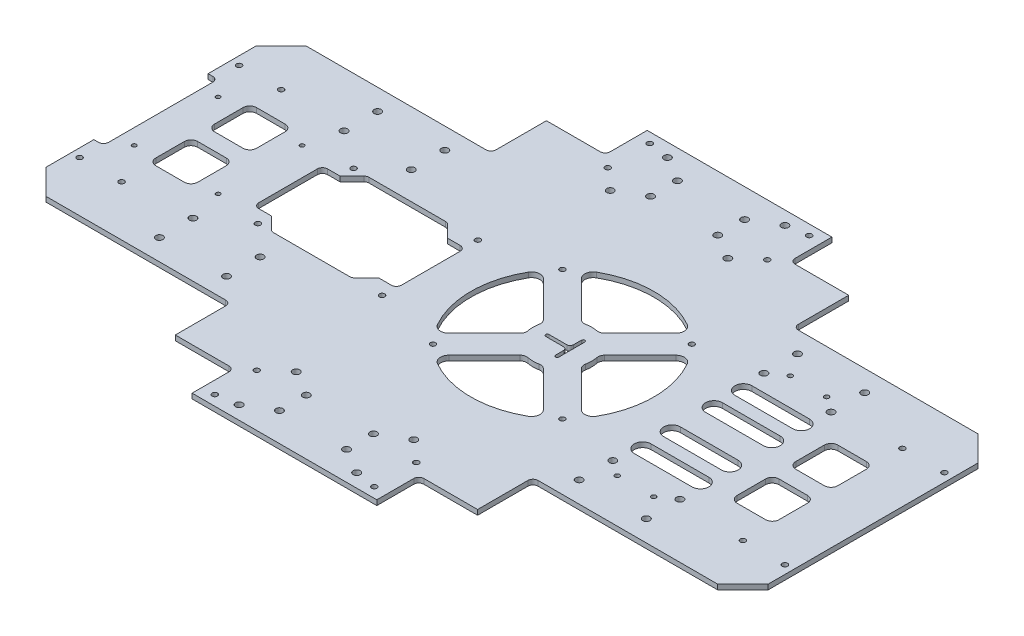
from build123d import *

# Parameters (mm, degrees)
EXTRUDE_1_DEPTH     = 3
FILLET_1_R          = 3
SKETCH_2_R          = 1.6
CUT_EXTRUDE_1_DEPTH = 47
SKETCH_3_R          = 2.1
SKETCH_3_R_2        = 1.4
SKETCH_3_R_3        = 1.25
CUT_EXTRUDE_2_DEPTH = 47
CHAMFER_1_SIZE      = 15
SKETCH_5_R          = 1.55
CUT_EXTRUDE_3_DEPTH = 47
SKETCH_6_R          = 1.6
CUT_EXTRUDE_4_DEPTH = 47
FILLET_2_R          = 3
CUT_EXTRUDE_5_DEPTH = 47
FILLET_3_R          = 3
CUT_EXTRUDE_6_DEPTH = 47
CUT_EXTRUDE_7_DEPTH = 10
FILLET_4_R          = 3
SKETCH_10_R         = 2.1
CUT_EXTRUDE_8_DEPTH = 10
SKETCH_11_R         = 2.1
CUT_EXTRUDE_9_DEPTH = 10


with BuildPart() as part:
    # 草图1 → 凸台-拉伸1 (new body)
    with BuildSketch(Plane(origin=(0, 0, 0), x_dir=(1, 0, 0), z_dir=(0, 1, 0))):
        Polygon((-82.930073268, 135.499923245), (-82.930073268, 112.499923245), (-47.930073268, 112.499923245), (-47.930073268, 77.499923245), (77.069926732, 77.499923245), (77.069926732, -77.499923245), (-47.930073268, -77.499923245), (-47.930073268, -112.499923245), (-82.930073268, -112.499923245), (-82.930073268, -135.499923245), (-192.930073268, -135.499923245), (-192.930073268, -112.499923245), (-227.930073268, -112.499923245), (-227.930073268, -77.499923245), (-352.930073268, -77.499923245), (-352.930073268, 77.499923245), (-227.930073268, 77.499923245), (-227.930073268, 112.499923245), (-192.930073268, 112.499923245), (-192.930073268, 135.499923245), align=None)
    extrude(amount=EXTRUDE_1_DEPTH)

    # 圆角1
    fillet_1_edges = [part.edges().sort_by_distance(p)[0] for p in [
        (-227.930073268, 1.5, 77.499923245),
        (-227.930073268, 1.5, -77.499923245),
        (-192.930073268, 1.5, -112.499923245),
        (-82.930073268, 1.5, -112.499923245),
        (-47.930073268, 1.5, -77.499923245),
        (-47.930073268, 1.5, 77.499923245),
        (-82.930073268, 1.5, 112.499923245),
        (-192.930073268, 1.5, 112.499923245),
    ]]
    fillet(fillet_1_edges, radius=FILLET_1_R)

    # 草图2 → 切除-拉伸1 (cut)
    with BuildSketch(Plane(origin=(0, 3, 0), x_dir=(1, 0, 0), z_dir=(0, 1, 0))):
        with Locations(Location((47.069926732, 47.5, 0), (0, 0, 270))):
            Circle(SKETCH_2_R)
        with Locations(Location((72.069926732, 47.5, 0), (0, 0, 270))):
            Circle(SKETCH_2_R)
        with Locations(Location((47.069926732, -47.5, 0), (0, 0, 270))):
            Circle(SKETCH_2_R)
        with Locations(Location((72.069926732, -47.5, 0), (0, 0, 270))):
            Circle(SKETCH_2_R)
        with Locations(Location((-185.430073268, 104.499923245, 0), (0, 0, 270))):
            Circle(SKETCH_2_R)
        with Locations(Location((-90.430073268, 129.499923245, 0), (0, 0, 270))):
            Circle(SKETCH_2_R)
        with Locations(Location((-90.430073268, 104.499923245, 0), (0, 0, 270))):
            Circle(SKETCH_2_R)
        with Locations(Location((-185.430073268, 129.499923245, 0), (0, 0, 270))):
            Circle(SKETCH_2_R)
        with Locations(Location((-185.430073268, -129.499923245, 0), (0, 0, 90))):
            Circle(SKETCH_2_R)
        with Locations(Location((-90.430073268, -104.499923245, 0), (0, 0, 90))):
            Circle(SKETCH_2_R)
        with Locations(Location((-90.430073268, -129.499923245, 0), (0, 0, 90))):
            Circle(SKETCH_2_R)
        with Locations(Location((-185.430073268, -104.499923245, 0), (0, 0, 90))):
            Circle(SKETCH_2_R)
        with Locations(Location((-347.930073268, -47.5, 0), (0, 0, 90))):
            Circle(SKETCH_2_R)
        with Locations(Location((-322.930073268, -47.5, 0), (0, 0, 90))):
            Circle(SKETCH_2_R)
        with Locations(Location((-347.930073268, 47.5, 0), (0, 0, 90))):
            Circle(SKETCH_2_R)
        with Locations(Location((-322.930073268, 47.5, 0), (0, 0, 90))):
            Circle(SKETCH_2_R)
    extrude(amount=-CUT_EXTRUDE_1_DEPTH, mode=Mode.SUBTRACT)

    # 草图3 → 切除-拉伸2 (cut)
    with BuildSketch(Plane(origin=(0, 3, 0), x_dir=(1, 0, 0), z_dir=(0, 1, 0))):
        with Locations(Location((-282.930073268, 65, 0), (0, 0, 270))):
            Circle(SKETCH_3_R)
        with Locations(Location((-282.930073268, 45, 0), (0, 0, 270))):
            Circle(SKETCH_3_R)
        with Locations(Location((-242.930073268, 65, 0), (0, 0, 270))):
            Circle(SKETCH_3_R)
        with Locations(Location((-242.930073268, 45, 0), (0, 0, 270))):
            Circle(SKETCH_3_R)
        with Locations(Location((-242.930073268, -45, 0), (0, 0, 90))):
            Circle(SKETCH_3_R)
        with Locations(Location((-242.930073268, -65, 0), (0, 0, 90))):
            Circle(SKETCH_3_R)
        with Locations(Location((-282.930073268, -45, 0), (0, 0, 90))):
            Circle(SKETCH_3_R)
        with Locations(Location((-282.930073268, -65, 0), (0, 0, 90))):
            Circle(SKETCH_3_R)
        with Locations(Location((7.069926732, -65, 0), (0, 0, 270))):
            Circle(SKETCH_3_R)
        with Locations(Location((7.069926732, -45, 0), (0, 0, 270))):
            Circle(SKETCH_3_R)
        with Locations(Location((-32.930073268, -65, 0), (0, 0, 270))):
            Circle(SKETCH_3_R)
        with Locations(Location((-32.930073268, -45, 0), (0, 0, 270))):
            Circle(SKETCH_3_R)
        with Locations(Location((-32.930073268, 45, 0), (0, 0, 90))):
            Circle(SKETCH_3_R)
        with Locations(Location((-32.930073268, 65, 0), (0, 0, 90))):
            Circle(SKETCH_3_R)
        with Locations(Location((7.069926732, 45, 0), (0, 0, 90))):
            Circle(SKETCH_3_R)
        with Locations(Location((7.069926732, 65, 0), (0, 0, 90))):
            Circle(SKETCH_3_R)
        with Locations(Location((-23.76704514, -51.499999755, 0), (0, 0, 270))):
            Circle(SKETCH_3_R_2)
        with Locations(Location((-2.093100904, -51.499999755, 0), (0, 0, 270))):
            Circle(SKETCH_3_R_2)
        with Locations(Location((-23.767045988, 51.50000033, 0), (0, 0, 270))):
            Circle(SKETCH_3_R_2)
        with Locations(Location((-2.09310104, 51.50000033, 0), (0, 0, 270))):
            Circle(SKETCH_3_R_2)
        with Locations(Location((-337.930073268, 25, 0), (0, 0, 270))):
            Circle(SKETCH_3_R_3)
        with Locations(Location((-287.930073268, 25, 0), (0, 0, 270))):
            Circle(SKETCH_3_R_3)
        with Locations(Location((-287.930073268, -25, 0), (0, 0, 270))):
            Circle(SKETCH_3_R_3)
        with Locations(Location((-337.930073268, -25, 0), (0, 0, 270))):
            Circle(SKETCH_3_R_3)
        with BuildLine():
            Line((-30.125760882, 35), (4.265614346, 35))
            ThreePointArc((4.265614346, 35), (9.265614346, 30), (4.265614346, 25))
            Line((4.265614346, 25), (-8.930073268, 25))
            Line((-8.930073268, 25), (-12.930073268, 25))
            Line((-12.930073268, 25), (-30.125760882, 25))
            ThreePointArc((-30.125760882, 25), (-35.125760882, 30), (-30.125760882, 35))
        make_face()
        with BuildLine():
            Line((-30.125760882, 17.5), (4.265614346, 17.5))
            ThreePointArc((4.265614346, 17.5), (9.265614346, 12.5), (4.265614346, 7.5))
            Line((4.265614346, 7.5), (-30.125760882, 7.5))
            ThreePointArc((-30.125760882, 7.5), (-35.125760882, 12.5), (-30.125760882, 17.5))
        make_face()
        with BuildLine():
            Line((-30.125760882, -35), (4.265614346, -35))
            ThreePointArc((4.265614346, -35), (9.265614346, -30), (4.265614346, -25))
            Line((4.265614346, -25), (-30.125760882, -25))
            ThreePointArc((-30.125760882, -25), (-35.125760882, -30), (-30.125760882, -35))
        make_face()
        with BuildLine():
            Line((-30.125760882, -17.5), (4.265614346, -17.5))
            ThreePointArc((4.265614346, -17.5), (9.265614346, -12.5), (4.265614346, -7.5))
            Line((4.265614346, -7.5), (-30.125760882, -7.5))
            ThreePointArc((-30.125760882, -7.5), (-35.125760882, -12.5), (-30.125760882, -17.5))
        make_face()
    extrude(amount=-CUT_EXTRUDE_2_DEPTH, mode=Mode.SUBTRACT)

    # 倒角1
    chamfer_1_edges = [part.edges().sort_by_distance(p)[0] for p in [
        (-352.930073268, 1.5, 77.499923245),
        (-352.930073268, 1.5, -77.499923245),
        (77.069926732, 1.5, -77.499923245),
        (77.069926732, 1.5, 77.499923245),
    ]]
    chamfer(chamfer_1_edges, length=CHAMFER_1_SIZE)

    # 草图5 → 切除-拉伸3 (cut)
    with BuildSketch(Plane(origin=(0, 3, 0), x_dir=(1, 0, 0), z_dir=(0, 1, 0))):
        with Locations(Location((-69.392753694, 38.537319575, 0), (0, 0, 270))):
            Circle(SKETCH_5_R)
        with Locations(Location((-69.392753694, -38.537319575, 0), (0, 0, 270))):
            Circle(SKETCH_5_R)
        with Locations(Location((-146.467392843, -38.537319575, 0), (0, 0, 270))):
            Circle(SKETCH_5_R)
        with Locations(Location((-146.467392843, 38.537319575, 0), (0, 0, 270))):
            Circle(SKETCH_5_R)
        with BuildLine():
            Line((-68.500078803, 28.116285966), (-89.658743207, 6.957621562))
            ThreePointArc((-89.658743207, 6.957621562), (-90.656276987, 5.296251914), (-90.755852303, 3.360972216))
            ThreePointArc((-90.755852303, 3.360972216), (-90.430073268, 0), (-90.755852303, -3.360972216))
            ThreePointArc((-90.755852303, -3.360972216), (-90.656276987, -5.296251914), (-89.658743207, -6.957621562))
            Line((-89.658743207, -6.957621562), (-68.500078803, -28.116285966))
            ThreePointArc((-68.500078803, -28.116285966), (-64.302140518, -29.536679868), (-60.624592537, -27.063656308))
            ThreePointArc((-60.624592537, -27.063656308), (-53.430073268, 0), (-60.624592537, 27.063656308))
            ThreePointArc((-60.624592537, 27.063656308), (-64.302140518, 29.536679868), (-68.500078803, 28.116285966))
        make_face()
        with BuildLine():
            Line((-79.813787302, -39.429994465), (-100.972451706, -18.271330061))
            ThreePointArc((-100.972451706, -18.271330061), (-102.633821354, -17.273796281), (-104.569101052, -17.174220965))
            ThreePointArc((-104.569101052, -17.174220965), (-107.930073268, -17.5), (-111.291045485, -17.174220965))
            ThreePointArc((-111.291045485, -17.174220965), (-113.226325182, -17.273796281), (-114.88769483, -18.271330061))
            Line((-114.88769483, -18.271330061), (-136.046359234, -39.429994465))
            ThreePointArc((-136.046359234, -39.429994465), (-137.466753136, -43.62793275), (-134.993729577, -47.305480731))
            ThreePointArc((-134.993729577, -47.305480731), (-107.930073268, -54.5), (-80.86641696, -47.305480731))
            ThreePointArc((-80.86641696, -47.305480731), (-78.3933934, -43.62793275), (-79.813787302, -39.429994465))
        make_face()
        with BuildLine():
            Line((-147.360067733, -28.116285966), (-126.201403329, -6.957621562))
            ThreePointArc((-126.201403329, -6.957621562), (-125.203869549, -5.296251914), (-125.104294233, -3.360972216))
            ThreePointArc((-125.104294233, -3.360972216), (-125.430073268, 0), (-125.104294233, 3.360972216))
            ThreePointArc((-125.104294233, 3.360972216), (-125.203869549, 5.296251914), (-126.201403329, 6.957621562))
            Line((-126.201403329, 6.957621562), (-147.360067733, 28.116285966))
            ThreePointArc((-147.360067733, 28.116285966), (-151.558006018, 29.536679868), (-155.235554, 27.063656308))
            ThreePointArc((-155.235554, 27.063656308), (-162.430073268, 0), (-155.235554, -27.063656308))
            ThreePointArc((-155.235554, -27.063656308), (-151.558006018, -29.536679868), (-147.360067733, -28.116285966))
        make_face()
        with BuildLine():
            Line((-136.046359234, 39.429994465), (-114.88769483, 18.271330061))
            ThreePointArc((-114.88769483, 18.271330061), (-113.226325182, 17.273796281), (-111.291045485, 17.174220965))
            ThreePointArc((-111.291045485, 17.174220965), (-107.930073268, 17.5), (-104.569101052, 17.174220965))
            ThreePointArc((-104.569101052, 17.174220965), (-102.633821354, 17.273796281), (-100.972451706, 18.271330061))
            Line((-100.972451706, 18.271330061), (-79.813787302, 39.429994465))
            ThreePointArc((-79.813787302, 39.429994465), (-78.3933934, 43.62793275), (-80.86641696, 47.305480731))
            ThreePointArc((-80.86641696, 47.305480731), (-107.930073268, 54.5), (-134.993729577, 47.305480731))
            ThreePointArc((-134.993729577, 47.305480731), (-137.466753136, 43.62793275), (-136.046359234, 39.429994465))
        make_face()
        with BuildLine():
            Line((-102.329796638, -7.703070081), (-102.329796638, 7.767864593))
            ThreePointArc((-102.329796638, 7.767864593), (-103.329796638, 8.767864593), (-104.329796638, 7.767864593))
            Line((-104.329796638, 7.767864593), (-104.329796638, 3.032397256))
            ThreePointArc((-104.329796638, 3.032397256), (-104.915583076, 1.618183694), (-106.329796638, 1.032397256))
            Line((-106.329796638, 1.032397256), (-116.930073268, 1.032397256))
            ThreePointArc((-116.930073268, 1.032397256), (-117.930073268, 0.032397256), (-116.930073268, -0.967602744))
            Line((-116.930073268, -0.967602744), (-106.329796638, -0.967602744))
            ThreePointArc((-106.329796638, -0.967602744), (-104.915583076, -1.553389182), (-104.329796638, -2.967602744))
            Line((-104.329796638, -2.967602744), (-104.329796638, -7.703070081))
            ThreePointArc((-104.329796638, -7.703070081), (-103.329796638, -8.703070081), (-102.329796638, -7.703070081))
        make_face()
    extrude(amount=-CUT_EXTRUDE_3_DEPTH, mode=Mode.SUBTRACT)

    # 草图6 → 切除-拉伸4 (cut)
    with BuildSketch(Plane(origin=(0, 3, 0), x_dir=(1, 0, 0), z_dir=(0, 1, 0))):
        with Locations(Location((-260.782474962, 28.5, 0), (0, 0, 270))):
            Circle(SKETCH_6_R)
        with Locations(Location((-186.782474962, 28.5, 0), (0, 0, 270))):
            Circle(SKETCH_6_R)
        with Locations(Location((-260.782474962, -28.5, 0), (0, 0, 270))):
            Circle(SKETCH_6_R)
        with Locations(Location((-186.782474962, -28.5, 0), (0, 0, 270))):
            Circle(SKETCH_6_R)
        Polygon((-270.282474962, -20.5), (-260.782474962, -20.5), (-252.782474962, -28.5), (-204.782474962, -28.5), (-196.782474962, -20.5), (-187.282474962, -20.5), (-186.282474962, -20.5), (-186.282474962, -19.5), (-186.282474962, 19.5), (-186.282474962, 20.5), (-187.282474962, 20.5), (-196.782474962, 20.5), (-204.782474962, 28.5), (-252.782474962, 28.5), (-260.782474962, 20.5), (-270.282474962, 20.5), (-271.282474962, 20.5), (-271.282474962, 19.5), (-271.282474962, -19.5), (-271.282474962, -20.5), align=None)
    extrude(amount=-CUT_EXTRUDE_4_DEPTH, mode=Mode.SUBTRACT)

    # 圆角2
    fillet_2_edges = [part.edges().sort_by_distance(p)[0] for p in [
        (-271.282474962, 1.5, 20.5),
        (-271.282474962, 1.5, -20.5),
        (-252.782474962, 1.5, -28.5),
        (-204.782474962, 1.5, -28.5),
        (-186.282474962, 1.5, -20.5),
        (-186.282474962, 1.5, 20.5),
        (-204.782474962, 1.5, 28.5),
        (-252.782474962, 1.5, 28.5),
    ]]
    fillet(fillet_2_edges, radius=FILLET_2_R)

    # 草图7 → 切除-拉伸5 (cut)
    with BuildSketch(Plane(origin=(0, 3, 0), x_dir=(1, 0, 0), z_dir=(0, 1, 0))):
        Polygon((-347.130073268, 0), (-347.130073268, 34), (-352.930073268, 34), (-352.930073268, -34), (-347.130073268, -34), align=None)
    extrude(amount=-CUT_EXTRUDE_5_DEPTH, mode=Mode.SUBTRACT)

    # 圆角3
    fillet_3_edges = [part.edges().sort_by_distance(p)[0] for p in [
        (-347.130073268, 1.5, 34),
        (-347.130073268, 1.5, -34),
    ]]
    fillet(fillet_3_edges, radius=FILLET_3_R)

    # 草图8 → 切除-拉伸6 (cut)
    with BuildSketch(Plane(origin=(0, 3, 0), x_dir=(1, 0, 0), z_dir=(0, 1, 0))):
        with BuildLine():
            Line((-321.030465446, 5.960941227), (-304.030465446, 5.960941227))
            ThreePointArc((-304.030465446, 5.960941227), (-301.202038321, 7.132514102), (-300.030465446, 9.960941227))
            Line((-300.030465446, 9.960941227), (-300.030465446, 26.960941227))
            ThreePointArc((-300.030465446, 26.960941227), (-301.202038321, 29.789368352), (-304.030465446, 30.960941227))
            Line((-304.030465446, 30.960941227), (-321.030465446, 30.960941227))
            ThreePointArc((-321.030465446, 30.960941227), (-323.858892571, 29.789368352), (-325.030465446, 26.960941227))
            Line((-325.030465446, 26.960941227), (-325.030465446, 9.960941227))
            ThreePointArc((-325.030465446, 9.960941227), (-323.858892571, 7.132514102), (-321.030465446, 5.960941227))
        make_face()
        with BuildLine():
            Line((-300.030465446, -8.039058773), (-300.030465446, -25.039058773))
            ThreePointArc((-300.030465446, -25.039058773), (-301.202038321, -27.867485898), (-304.030465446, -29.039058773))
            Line((-304.030465446, -29.039058773), (-321.030465446, -29.039058773))
            ThreePointArc((-321.030465446, -29.039058773), (-323.858892571, -27.867485898), (-325.030465446, -25.039058773))
            Line((-325.030465446, -25.039058773), (-325.030465446, -8.039058773))
            ThreePointArc((-325.030465446, -8.039058773), (-323.858892571, -5.210631648), (-321.030465446, -4.039058773))
            Line((-321.030465446, -4.039058773), (-304.030465446, -4.039058773))
            ThreePointArc((-304.030465446, -4.039058773), (-301.202038321, -5.210631648), (-300.030465446, -8.039058773))
        make_face()
        with BuildLine():
            ThreePointArc((22.069926732, 26), (23.241499607, 28.828427125), (26.069926732, 30))
            Line((26.069926732, 30), (43.069926732, 30))
            ThreePointArc((43.069926732, 30), (45.898353857, 28.828427125), (47.069926732, 26))
            Line((47.069926732, 26), (47.069926732, 9))
            ThreePointArc((47.069926732, 9), (45.898353857, 6.171572875), (43.069926732, 5))
            Line((43.069926732, 5), (26.069926732, 5))
            ThreePointArc((26.069926732, 5), (23.241499607, 6.171572875), (22.069926732, 9))
            Line((22.069926732, 9), (22.069926732, 26))
        make_face()
        with BuildLine():
            Line((26.069926732, -5), (43.069926732, -5))
            ThreePointArc((43.069926732, -5), (45.898353857, -6.171572875), (47.069926732, -9))
            Line((47.069926732, -9), (47.069926732, -26))
            ThreePointArc((47.069926732, -26), (45.898353857, -28.828427125), (43.069926732, -30))
            Line((43.069926732, -30), (26.069926732, -30))
            ThreePointArc((26.069926732, -30), (23.241499607, -28.828427125), (22.069926732, -26))
            Line((22.069926732, -26), (22.069926732, -9))
            ThreePointArc((22.069926732, -9), (23.241499607, -6.171572875), (26.069926732, -5))
        make_face()
    extrude(amount=-CUT_EXTRUDE_6_DEPTH, mode=Mode.SUBTRACT)

    # 草图9 → 切除-拉伸7 (cut)
    with BuildSketch(Plane(origin=(0, 3, 0), x_dir=(1, 0, 0), z_dir=(0, 1, 0))):
        Polygon((-227.930073268, 112.499923245), (-198.566720151, 112.499923245), (-197.043508076, 116.77154794), (-192.930073268, 116.77154794), (-192.930073268, 112.499923245), (-192.930073268, 110.499923245), (-227.930073268, 110.499923245), align=None)
        Polygon((-78.816638461, 116.77154794), (-77.293426385, 112.499923245), (-47.930073268, 112.499923245), (-47.930073268, 110.499923245), (-82.930073268, 110.499923245), (-82.930073268, 112.499923245), (-82.930073268, 116.77154794), align=None)
        Polygon((-47.930073268, -112.499923245), (-77.293426385, -112.499923245), (-78.816638461, -116.77154794), (-82.930073268, -116.77154794), (-82.930073268, -112.499923245), (-82.930073268, -110.499923245), (-47.930073268, -110.499923245), align=None)
        Polygon((-197.043508076, -116.77154794), (-198.566720151, -112.499923245), (-227.930073268, -112.499923245), (-227.930073268, -110.499923245), (-192.930073268, -110.499923245), (-192.930073268, -112.499923245), (-192.930073268, -116.77154794), align=None)
    extrude(amount=-CUT_EXTRUDE_7_DEPTH, mode=Mode.SUBTRACT)

    # 圆角4
    fillet_4_edges = [part.edges().sort_by_distance(p)[0] for p in [
        (-192.930073268, 1.5, -110.499923245),
        (-82.930073268, 1.5, -110.499923245),
        (-82.930073268, 1.5, 110.499923245),
        (-192.930073268, 1.5, 110.499923245),
    ]]
    fillet(fillet_4_edges, radius=FILLET_4_R)

    # 草图10 → 切除-拉伸8 (cut)
    with BuildSketch(Plane(origin=(0, 3, 0), x_dir=(1, 0, 0), z_dir=(0, 1, 0))):
        with Locations(Location((-172.930073268, 127.499923245, 0), (0, 0, 270))):
            Circle(SKETCH_10_R)
        with Locations(Location((-157.930073268, 118.499923245, 0), (0, 0, 270))):
            Circle(SKETCH_10_R)
        with Locations(Location((-117.930073268, 118.499923245, 0), (0, 0, 90))):
            Circle(SKETCH_10_R)
        with Locations(Location((-102.930073268, 127.499923245, 0), (0, 0, 90))):
            Circle(SKETCH_10_R)
        with Locations(Location((-102.930073268, -127.499923245, 0), (0, 0, 270))):
            Circle(SKETCH_10_R)
        with Locations(Location((-117.930073268, -118.499923245, 0), (0, 0, 270))):
            Circle(SKETCH_10_R)
        with Locations(Location((-157.930073268, -118.499923245, 0), (0, 0, 90))):
            Circle(SKETCH_10_R)
        with Locations(Location((-172.930073268, -127.499923245, 0), (0, 0, 90))):
            Circle(SKETCH_10_R)
    extrude(amount=-CUT_EXTRUDE_8_DEPTH, mode=Mode.SUBTRACT)

    # 草图11 → 切除-拉伸9 (cut)
    with BuildSketch(Plane(origin=(0, 3, 0), x_dir=(1, 0, 0), z_dir=(0, 1, 0))):
        with Locations(Location((-102.930073268, 93.499923245, 0), (0, 0, 90))):
            Circle(SKETCH_11_R)
        with Locations(Location((-117.930073268, 102.499923245, 0), (0, 0, 90))):
            Circle(SKETCH_11_R)
        with Locations(Location((-157.930073268, 102.499923245, 0), (0, 0, 90))):
            Circle(SKETCH_11_R)
        with Locations(Location((-172.930073268, 93.499923245, 0), (0, 0, 90))):
            Circle(SKETCH_11_R)
        with Locations(Location((-172.930073268, -93.499923245, 0), (0, 0, 270))):
            Circle(SKETCH_11_R)
        with Locations(Location((-157.930073268, -102.499923245, 0), (0, 0, 270))):
            Circle(SKETCH_11_R)
        with Locations(Location((-117.930073268, -102.499923245, 0), (0, 0, 270))):
            Circle(SKETCH_11_R)
        with Locations(Location((-102.930073268, -93.499923245, 0), (0, 0, 270))):
            Circle(SKETCH_11_R)
    extrude(amount=-CUT_EXTRUDE_9_DEPTH, mode=Mode.SUBTRACT)


solid = part.part
